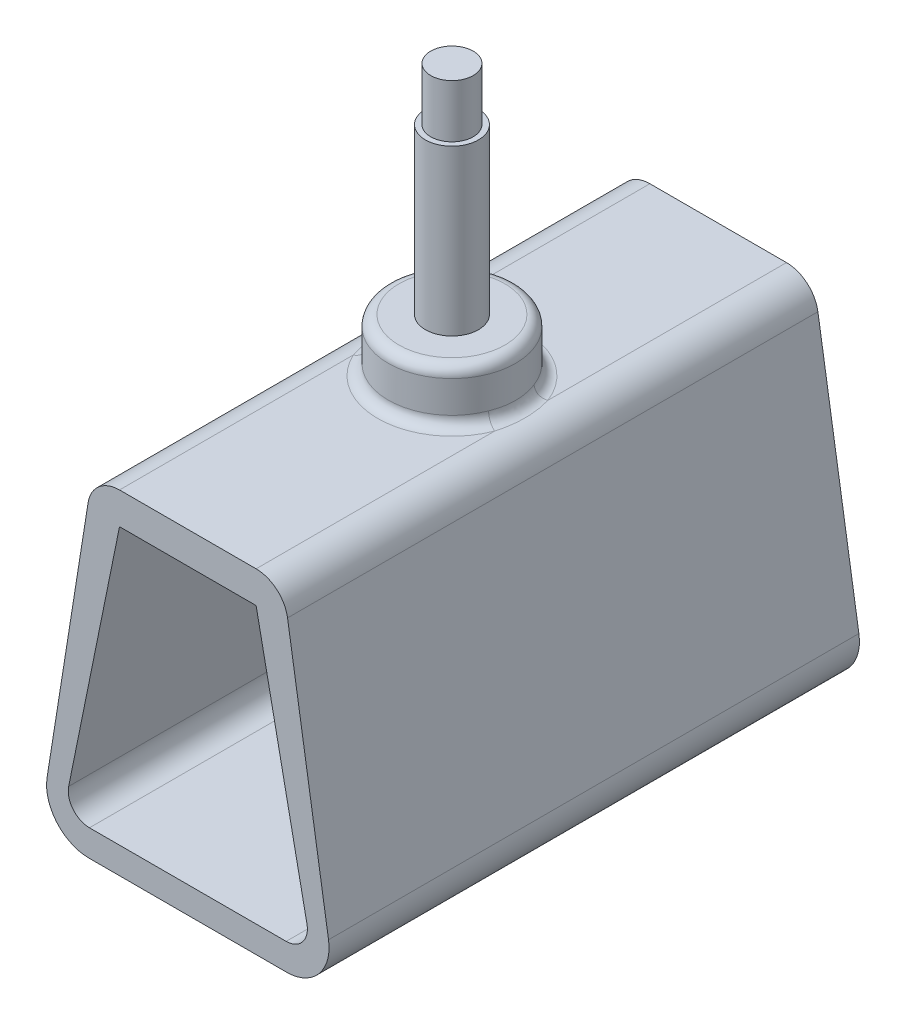
from build123d import *

# Parameters (mm, degrees)
SALIENTE_EXTRUIR1_DEPTH = 50
CROQUIS2_R              = 6
CROQUIS2_R_2            = 2.5
SALIENTE_EXTRUIR2_DEPTH = 5
SALIENTE_EXTRUIR3_START = 5
CROQUIS2_3_R            = 2.5
SALIENTE_EXTRUIR3_DEPTH = 15.5
SALIENTE_EXTRUIR4_START = 20.5
CROQUIS2_4_R            = 2
SALIENTE_EXTRUIR4_DEPTH = 5
REDONDEO1_R             = 1


with BuildPart() as part:
    # Croquis1 → Saliente-Extruir1 (new body)
    with BuildSketch(Plane.XY):
        with BuildLine():
            Line((4.684997697, 0), (23.315002303, 0))
            ThreePointArc((23.315002303, 0), (26.357064161, 1.402720722), (27.265544416, 4.627070177))
            Line((27.265544416, 4.627070177), (23.401539265, 28.970302633))
            ThreePointArc((23.401539265, 28.970302633), (22.386592138, 30.781546394), (20.438632679, 31.5))
            Line((20.438632679, 31.5), (7.561367321, 31.5))
            ThreePointArc((7.561367321, 31.5), (5.613407862, 30.781546394), (4.598460735, 28.970302633))
            Line((4.598460735, 28.970302633), (0.734455584, 4.627070177))
            ThreePointArc((0.734455584, 4.627070177), (1.642935839, 1.402720722), (4.684997697, 0))
        make_face()
        with BuildLine():
            Line((7.561367321, 28.5), (20.438632679, 28.5))
            Line((20.438632679, 28.5), (25.232423855, 4.898092227))
            ThreePointArc((25.232423855, 4.898092227), (24.821021091, 3.234335047), (23.272443606, 2.5))
            Line((23.272443606, 2.5), (4.727556394, 2.5))
            ThreePointArc((4.727556394, 2.5), (3.178978909, 3.234335047), (2.767576145, 4.898092227))
            Line((2.767576145, 4.898092227), (7.561367321, 28.5))
        make_face(mode=Mode.SUBTRACT)
    extrude(amount=-SALIENTE_EXTRUIR1_DEPTH)

    # Croquis2 → Saliente-Extruir2 (add)
    with BuildSketch(Plane(origin=(0, 31.5, 0), x_dir=(1, 0, 0), z_dir=(0, 1, 0))):
        with Locations(Location((13.901539265, 25, 0), (0, 0, 270))):
            Circle(CROQUIS2_R)
        with Locations(Location((13.901539265, 25, 0), (0, 0, 270))):
            Circle(CROQUIS2_R_2, mode=Mode.SUBTRACT)
    extrude(amount=SALIENTE_EXTRUIR2_DEPTH)

    # Redondeo1
    redondeo1_edges = [part.edges().sort_by_distance(p)[0] for p in [
        (13.901539265, 31.5, -31),
        (13.901539265, 36.5, -31),
    ]]
    fillet(redondeo1_edges, radius=REDONDEO1_R)


with BuildPart() as body_2:
    # Croquis2<3> → Saliente-Extruir3 (new body)
    with BuildSketch(Plane(origin=(0, 31.5, 0), x_dir=(1, 0, 0), z_dir=(0, 1, 0)).offset(SALIENTE_EXTRUIR3_START)):
        with Locations(Location((13.901539265, 25, 0), (0, 0, 270))):
            Circle(CROQUIS2_3_R)
    extrude(amount=SALIENTE_EXTRUIR3_DEPTH)


with BuildPart() as body_3:
    # Croquis2<4> → Saliente-Extruir4 (new body)
    with BuildSketch(Plane(origin=(0, 31.5, 0), x_dir=(1, 0, 0), z_dir=(0, 1, 0)).offset(SALIENTE_EXTRUIR4_START)):
        with Locations(Location((13.901539265, 25, 0), (0, 0, 270))):
            Circle(CROQUIS2_4_R)
    extrude(amount=SALIENTE_EXTRUIR4_DEPTH)


solid = Compound([part.part, body_2.part, body_3.part])
